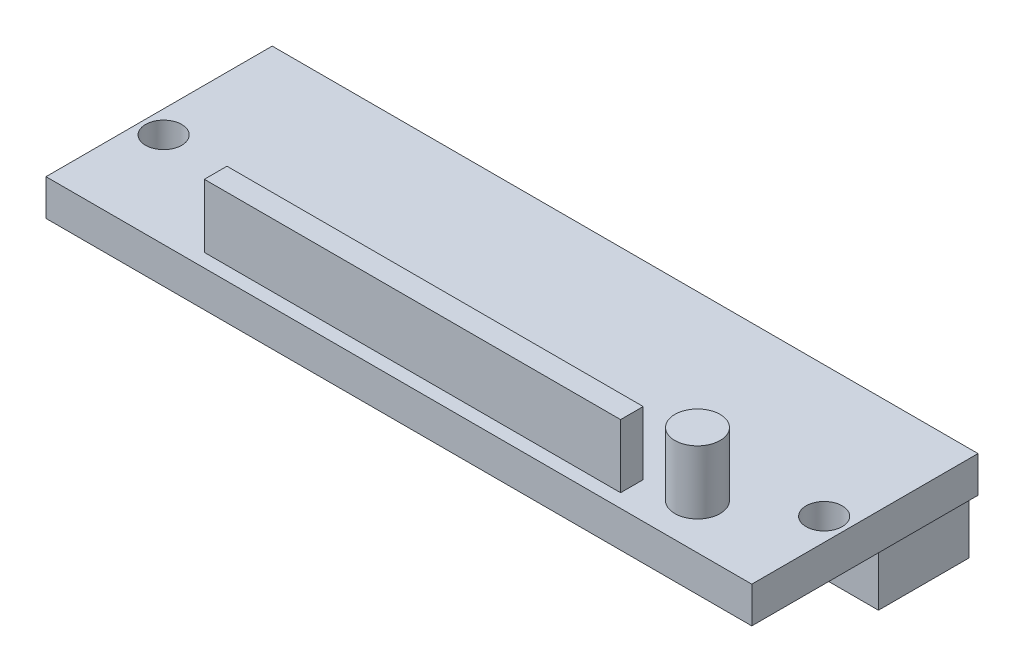
from build123d import *

# Parameters (mm, degrees)
SKETCH1_W           = 78
SKETCH1_H           = 25
BOSS_EXTRUDE1_DEPTH = 4
SKETCH2_R           = 2.5
SKETCH2_W           = 46
SKETCH2_H           = 2.5
BOSS_EXTRUDE2_DEPTH = 7
SKETCH3_W           = 5.5
SKETCH3_H           = 10
BOSS_EXTRUDE3_DEPTH = 6.5
SKETCH4_R           = 2
CUT_EXTRUDE1_DEPTH  = 10


with BuildPart() as part:
    # Sketch1 → Boss-Extrude1 (new body)
    with BuildSketch(Plane(origin=(0, 0, 0), x_dir=(1, 0, 0), z_dir=(0, 1, 0))):
        Rectangle(SKETCH1_W, SKETCH1_H)
    extrude(amount=BOSS_EXTRUDE1_DEPTH)

    # Sketch2 → Boss-Extrude2 (add)
    with BuildSketch(Plane(origin=(0, 4, 0), x_dir=(1, 0, 0), z_dir=(0, 1, 0))):
        with Locations(Location((28, -7.5, 0), (0, 0, 90))):
            Circle(SKETCH2_R)
        with Locations((0, -9.75)):
            Rectangle(SKETCH2_W, SKETCH2_H)
    extrude(amount=BOSS_EXTRUDE2_DEPTH)

    # Sketch3 → Boss-Extrude3 (add)
    with BuildSketch(Plane.XZ):
        with Locations((-35.25, -7.5)):
            Rectangle(SKETCH3_W, SKETCH3_H)
        with Locations((-25.178571429, -7.5)):
            Rectangle(SKETCH3_W, SKETCH3_H)
        with Locations((-15.107142857, -7.5)):
            Rectangle(SKETCH3_W, SKETCH3_H)
        with Locations((-5.035714286, -7.5)):
            Rectangle(SKETCH3_W, SKETCH3_H)
        with Locations((5.035714286, -7.5)):
            Rectangle(SKETCH3_W, SKETCH3_H)
        with Locations((15.107142857, -7.5)):
            Rectangle(SKETCH3_W, SKETCH3_H)
        with Locations((25.178571429, -7.5)):
            Rectangle(SKETCH3_W, SKETCH3_H)
        with Locations((35.25, -7.5)):
            Rectangle(SKETCH3_W, SKETCH3_H)
    extrude(amount=BOSS_EXTRUDE3_DEPTH)

    # Sketch4 → Cut-Extrude1 (cut)
    with BuildSketch(Plane(origin=(0, 4, 0), x_dir=(1, 0, 0), z_dir=(0, 1, 0))):
        with Locations(Location((-36.5, -2, 0), (0, 0, 270))):
            Circle(SKETCH4_R)
        with Locations(Location((36.5, -2, 0), (0, 0, 90))):
            Circle(SKETCH4_R)
    extrude(amount=-CUT_EXTRUDE1_DEPTH, mode=Mode.SUBTRACT)


solid = part.part
